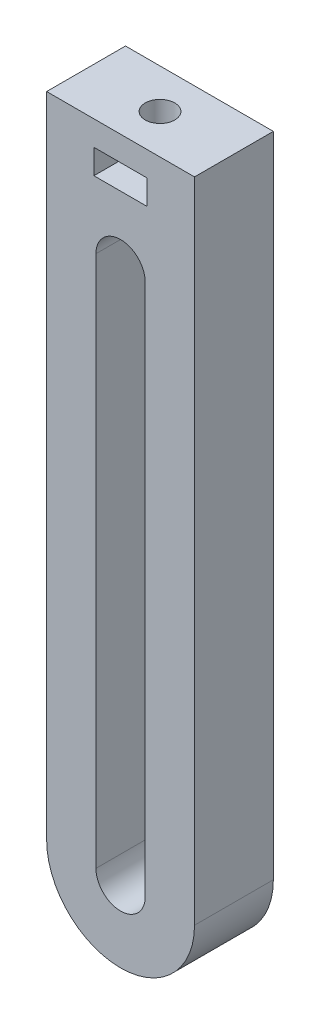
from build123d import *

# Parameters (mm, degrees)
BOSS_EXTRUDE1_DEPTH     = 8
CUT_EXTRUDE2_START      = -2.5
CUT_EXTRUDE2_DEPTH      = 2.5
SKETCH4_W               = 5.41
SKETCH4_H               = 2.5
CUT_EXTRUDE3_DEPTH      = 4
CUT_EXTRUDE4_REACH      = 76.066
CUT_EXTRUDE4_END_RADIUS = 2.5
SKETCH5_R               = 1.5


with BuildPart() as part:
    # Sketch1 → Boss-Extrude1 (new body)
    with BuildSketch(Plane.XY):
        with BuildLine():
            Line((-7.5, 38.75), (7.5, 38.75))
            Line((7.5, 38.75), (7.5, -27))
            ThreePointArc((7.5, -27), (0, -34.5), (-7.5, -27))
            Line((-7.5, -27), (-7.5, 38.75))
        make_face()
        with BuildLine():
            Line((2.5, 27), (2.5, -27))
            ThreePointArc((2.5, -27), (0, -29.5), (-2.5, -27))
            Line((-2.5, -27), (-2.5, 27))
            ThreePointArc((-2.5, 27), (0, 29.5), (2.5, 27))
        make_face(mode=Mode.SUBTRACT)
    extrude(amount=BOSS_EXTRUDE1_DEPTH)

    # Sketch3 → Cut-Extrude2 (cut)
    with BuildSketch(Plane(origin=(0, 38.75, 0), x_dir=(1, 0, 0), z_dir=(0, 1, 0)).offset(CUT_EXTRUDE2_START)):
        Polygon((0, -7.123464956), (2.705, -5.561732478), (2.705, -2.438267522), (0, -0.876535044), (-2.705, -2.438267522), (-2.705, -5.561732478), align=None)
    extrude(amount=-CUT_EXTRUDE2_DEPTH, mode=Mode.SUBTRACT)

    # Sketch4 → Cut-Extrude3 (cut)
    with BuildSketch(Plane.XY.offset(8)):
        with Locations((0, 35)):
            Rectangle(SKETCH4_W, SKETCH4_H)
    extrude(amount=-CUT_EXTRUDE3_DEPTH, mode=Mode.SUBTRACT)

    # Cut-Extrude4: up to this cylinder (the profile starts outside it)
    cut_extrude4_end = Plane(origin=(0, 27, 4), z_dir=(0, 0, -1)) * Cylinder(CUT_EXTRUDE4_END_RADIUS, 158.132, mode=Mode.PRIVATE)
    # Sketch5 → Cut-Extrude4 (cut, up to the surface)
    with BuildSketch(Plane(origin=(0, 38.75, 0), x_dir=(1, 0, 0), z_dir=(0, 1, 0)), mode=Mode.PRIVATE) as cut_extrude4_sk1:
        with Locations(Location((0, -4, 0), (0, 0, 270))):
            Circle(SKETCH5_R)
    cut_extrude4_tool1 = extrude(cut_extrude4_sk1.sketch, amount=-CUT_EXTRUDE4_REACH, mode=Mode.PRIVATE) - cut_extrude4_end
    add(cut_extrude4_tool1.solids().sort_by_distance((0, 38.75, 4))[0], mode=Mode.SUBTRACT)


solid = part.part
